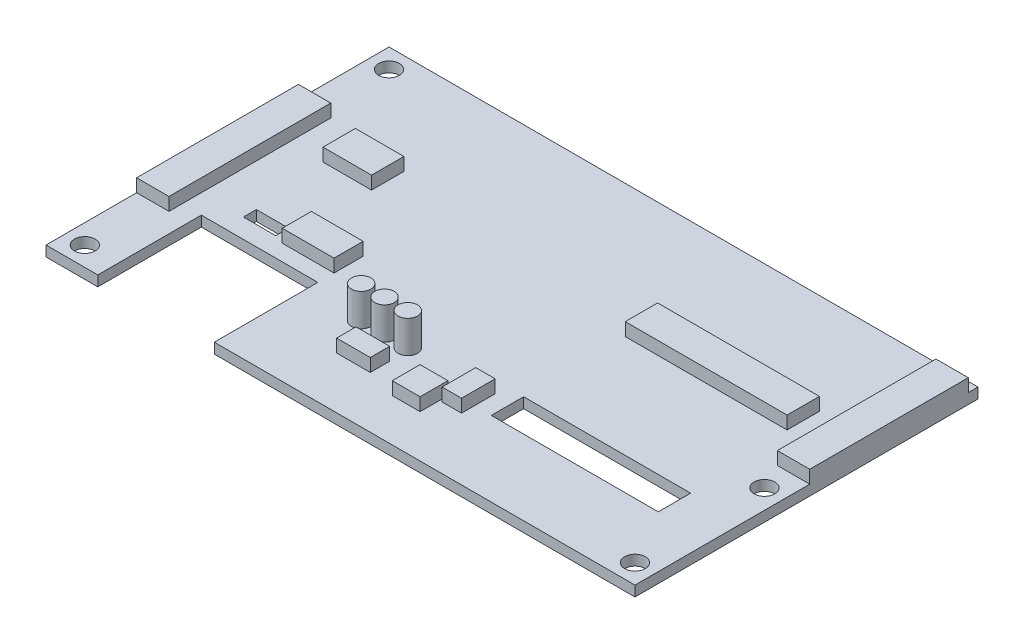
from build123d import *

# Parameters (mm, degrees)
SKETCH_2_R      = 1.6
SKETCH_2_W      = 5
SKETCH_2_H      = 2
SKETCH_2_W_2    = 25.8
SKETCH_2_H_2    = 5
EXTRUDE_1_DEPTH = 1.6
SKETCH_3_W      = 5
SKETCH_3_H      = 25
SKETCH_3_W_2    = 7.5
SKETCH_3_H_2    = 5
SKETCH_3_W_3    = 8
SKETCH_3_H_3    = 4.5
SKETCH_3_W_4    = 25
SKETCH_3_H_4    = 24.5
EXTRUDE_2_DEPTH = 2
SKETCH_4_R      = 1.5
EXTRUDE_3_DEPTH = 5
SKETCH_5_W      = 5.2
SKETCH_5_H      = 3
SKETCH_5_W_2    = 4.3
SKETCH_5_H_2    = 4.3
SKETCH_5_W_3    = 3
SKETCH_5_H_3    = 5.2
EXTRUDE_4_DEPTH = 2


with BuildPart() as part:
    # 草图2 → 凸台-拉伸1 (new body)
    with BuildSketch(Plane(origin=(0, 0, 0), x_dir=(1, 0, 0), z_dir=(0, 1, 0))):
        Polygon((0, 0), (0, -53), (8, -53), (8, -37), (26, -37), (26, -53), (91, -53), (91, 0), align=None)
        with Locations(Location((3, -50, 0), (0, 0, 270))):
            Circle(SKETCH_2_R, mode=Mode.SUBTRACT)
        with Locations(Location((3, -3, 0), (0, 0, 270))):
            Circle(SKETCH_2_R, mode=Mode.SUBTRACT)
        with Locations(Location((88, -30, 0), (0, 0, 270))):
            Circle(SKETCH_2_R, mode=Mode.SUBTRACT)
        with Locations(Location((88, -50, 0), (0, 0, 270))):
            Circle(SKETCH_2_R, mode=Mode.SUBTRACT)
        with Locations((14, -33)):
            Rectangle(SKETCH_2_W, SKETCH_2_H, mode=Mode.SUBTRACT)
        with Locations((70.1, -38.9)):
            Rectangle(SKETCH_2_W_2, SKETCH_2_H_2, mode=Mode.SUBTRACT)
    extrude(amount=EXTRUDE_1_DEPTH)

    # 草图3 → 凸台-拉伸2 (add)
    with BuildSketch(Plane(origin=(0, 1.6, 0), x_dir=(1, 0, 0), z_dir=(0, 1, 0))):
        with Locations((2.5, -26.5)):
            Rectangle(SKETCH_3_W, SKETCH_3_H)
        with Locations((14.05, -18)):
            Rectangle(SKETCH_3_W_2, SKETCH_3_H_2)
        with Locations((22, -32.25)):
            Rectangle(SKETCH_3_W_3, SKETCH_3_H_3)
        with Locations((69.5, -18)):
            Rectangle(SKETCH_3_W_4, SKETCH_3_H_2)
        with Locations((88.5, -13.75)):
            Rectangle(SKETCH_3_W, SKETCH_3_H_4)
    extrude(amount=EXTRUDE_2_DEPTH)

    # 草图4 → 凸台-拉伸3 (add)
    with BuildSketch(Plane(origin=(0, 1.6, 0), x_dir=(1, 0, 0), z_dir=(0, 1, 0))):
        with Locations(Location((34.5, -38.8, 0), (0, 0, 270))):
            Circle(SKETCH_4_R)
        with Locations(Location((38.1, -38.8, 0), (0, 0, 270))):
            Circle(SKETCH_4_R)
        with Locations(Location((41.7, -38.8, 0), (0, 0, 270))):
            Circle(SKETCH_4_R)
    extrude(amount=EXTRUDE_3_DEPTH)

    # 草图5 → 凸台-拉伸4 (add)
    with BuildSketch(Plane(origin=(0, 1.6, 0), x_dir=(1, 0, 0), z_dir=(0, 1, 0))):
        with Locations((39.5, -43.5)):
            Rectangle(SKETCH_5_W, SKETCH_5_H)
        with Locations((49.05, -44.25)):
            Rectangle(SKETCH_5_W_2, SKETCH_5_H_2)
        with Locations((53.1, -40.8)):
            Rectangle(SKETCH_5_W_3, SKETCH_5_H_3)
    extrude(amount=EXTRUDE_4_DEPTH)


solid = part.part
